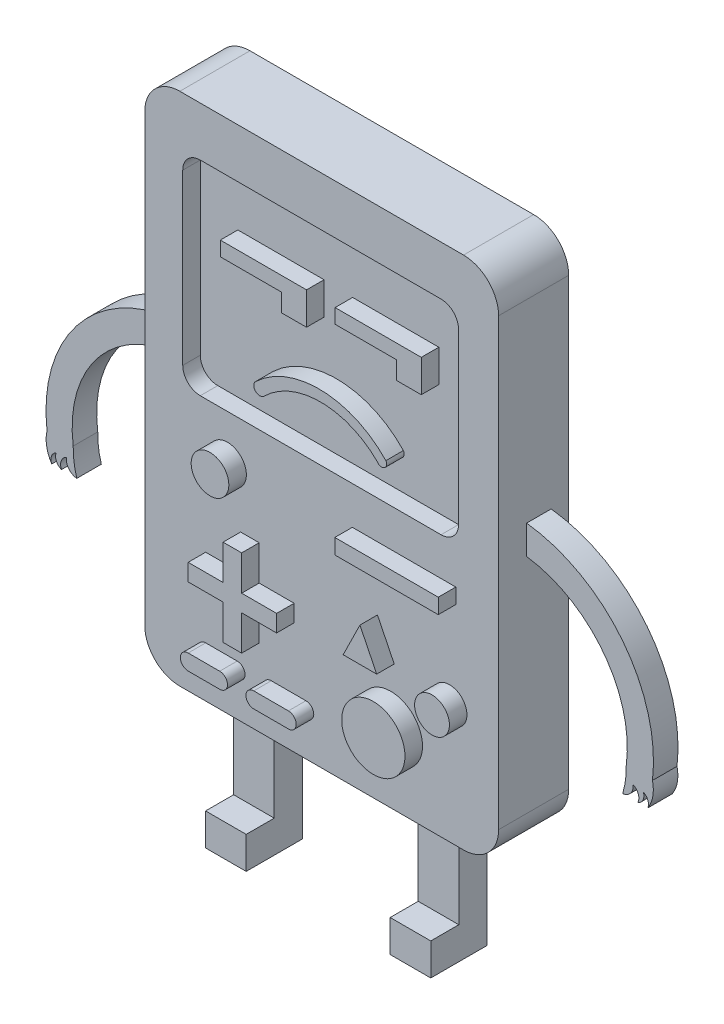
from build123d import *

# Parameters (mm, degrees)
SALIENTE_EXTRUIR1_DEPTH = 20
CORTAR_EXTRUIR1_DEPTH   = 5
CROQUIS4_R              = 5.371921572
CROQUIS4_R_2            = 4.964711246
CROQUIS4_R_3            = 9.020708029
CROQUIS4_W              = 29.502003405
CROQUIS4_H              = 4.3269605
SALIENTE_EXTRUIR2_DEPTH = 5
SALIENTE_EXTRUIR3_DEPTH = 7
SALIENTE_EXTRUIR4_DEPTH = 5
CROQUIS8_W              = 11.57899057
CROQUIS8_H              = 35.30452721
CROQUIS8_W_2            = 11.578990571
SALIENTE_EXTRUIR5_DEPTH = 8
CROQUIS10_W             = 11.578990571
CROQUIS10_H             = 9.157571022
CROQUIS10_W_2           = 11.57899057
SALIENTE_EXTRUIR6_DEPTH = 8


with BuildPart() as part:
    # Croquis2 → Saliente-Extruir1 (new body)
    with BuildSketch(Plane.XY):
        with BuildLine():
            Line((125.948771998, 73.831195148), (206.860426755, 73.831195148))
            ThreePointArc((206.860426755, 73.831195148), (213.931494567, 70.90226296), (216.860426755, 63.831195148))
            Line((216.860426755, 63.831195148), (216.860426755, -63.104823524))
            ThreePointArc((216.860426755, -63.104823524), (213.931494567, -70.175891336), (206.860426755, -73.104823524))
            Line((206.860426755, -73.104823524), (125.948771998, -73.104823524))
            ThreePointArc((125.948771998, -73.104823524), (118.877704186, -70.175891336), (115.948771998, -63.104823524))
            Line((115.948771998, -63.104823524), (115.948771998, 63.831195148))
            ThreePointArc((115.948771998, 63.831195148), (118.877704186, 70.90226296), (125.948771998, 73.831195148))
        make_face()
    extrude(amount=SALIENTE_EXTRUIR1_DEPTH)

    # Croquis3 → Cortar-Extruir1 (cut)
    with BuildSketch(Plane.XY.offset(20)):
        with BuildLine():
            Line((131.777213557, 1.543265948), (200.449222637, 1.543265948))
            ThreePointArc((200.449222637, 1.543265948), (203.984756543, 3.007732042), (205.449222637, 6.543265948))
            Line((205.449222637, 6.543265948), (205.449222637, 54.760552668))
            ThreePointArc((205.449222637, 54.760552668), (203.984756543, 58.296086574), (200.449222637, 59.760552668))
            Line((200.449222637, 59.760552668), (131.777213557, 59.760552668))
            ThreePointArc((131.777213557, 59.760552668), (128.241679651, 58.296086574), (126.777213557, 54.760552668))
            Line((126.777213557, 54.760552668), (126.777213557, 6.543265948))
            ThreePointArc((126.777213557, 6.543265948), (128.241679651, 3.007732042), (131.777213557, 1.543265948))
        make_face()
    extrude(amount=-CORTAR_EXTRUIR1_DEPTH, mode=Mode.SUBTRACT)

    # Croquis4 → Saliente-Extruir2 (add)
    with BuildSketch(Plane.XY.offset(20)):
        with Locations((139.552044207, -11.43761555)):
            Circle(CROQUIS4_R)
        with Locations((202.870894741, -39.254617567)):
            Circle(CROQUIS4_R_2)
        with Locations((186.137514813, -53.312706969)):
            Circle(CROQUIS4_R_3)
        with Locations((189.902130019, -11.43761555)):
            Rectangle(CROQUIS4_W, CROQUIS4_H)
        Polygon((143.285708697, -26.368371403), (148.582533347, -26.368371403), (148.582533347, -36.332523638), (158.546685582, -36.332523638), (158.546685582, -41.173023795), (148.582533347, -41.173023795), (148.582533347, -51.13717603), (143.285708697, -51.13717603), (143.285708697, -41.173023795), (133.321556462, -41.173023795), (133.321556462, -36.332523638), (143.285708697, -36.332523638), align=None)
        Polygon((177.531776564, -37.06014818), (182.312742258, -27.3361267), (187.093707951, -37.06014818), align=None)
        with BuildLine():
            Line((133.321556462, -58.731134755), (142.311995954, -58.731134755))
            ThreePointArc((142.311995954, -58.731134755), (144.543113278, -60.962252079), (142.311995954, -63.193369403))
            Line((142.311995954, -63.193369403), (133.321556462, -63.193369403))
            ThreePointArc((133.321556462, -63.193369403), (131.090439139, -60.962252079), (133.321556462, -58.731134755))
        make_face()
        with BuildLine():
            Line((152.033292864, -58.731134755), (161.913955298, -58.731134755))
            ThreePointArc((161.913955298, -58.731134755), (164.145072622, -60.962252079), (161.913955298, -63.193369403))
            Line((161.913955298, -63.193369403), (152.033292864, -63.193369403))
            ThreePointArc((152.033292864, -63.193369403), (149.802175541, -60.962252079), (152.033292864, -58.731134755))
        make_face()
    extrude(amount=SALIENTE_EXTRUIR2_DEPTH)

    # Croquis5 → Saliente-Extruir3 (add)
    with BuildSketch(Plane.XY.offset(5)):
        with BuildLine():
            Line((216.860426755, 0.363185812), (216.860426755, 8.623746765))
            ThreePointArc((216.860426755, 8.623746765), (244.254011859, -6.758756408), (252.747129342, -37.006018501))
            ThreePointArc((252.747129342, -37.006018501), (252.843911184, -40.891106139), (251.382973951, -44.492346907))
            ThreePointArc((251.382973951, -44.492346907), (251.453339476, -42.564380052), (250.139816979, -41.151345675))
            ThreePointArc((250.139816979, -41.151345675), (250.067291272, -43.138500016), (248.610877543, -44.492346907))
            ThreePointArc((248.610877543, -44.492346907), (248.688866874, -42.355493028), (247.233029791, -40.789362374))
            ThreePointArc((247.233029791, -40.789362374), (246.510434032, -43.257829455), (244.254011859, -44.492346907))
            ThreePointArc((244.254011859, -44.492346907), (245.058759657, -40.789362374), (245.273288479, -37.006018501))
            ThreePointArc((245.273288479, -37.006018501), (238.806273238, -12.436920009), (216.860426755, 0.363185812))
        make_face()
        with BuildLine():
            Line((115.948771998, 0.363185812), (115.948771998, 8.623746765))
            ThreePointArc((115.948771998, 8.623746765), (88.555186894, -6.758756408), (80.062069411, -37.006018501))
            ThreePointArc((80.062069411, -37.006018501), (79.965287568, -40.891106139), (81.426224802, -44.492346907))
            ThreePointArc((81.426224802, -44.492346907), (81.355859277, -42.564380052), (82.669381774, -41.151345675))
            ThreePointArc((82.669381774, -41.151345675), (82.741907481, -43.138500016), (84.19832121, -44.492346907))
            ThreePointArc((84.19832121, -44.492346907), (84.120331879, -42.355493028), (85.576168962, -40.789362374))
            ThreePointArc((85.576168962, -40.789362374), (86.29876472, -43.257829455), (88.555186894, -44.492346907))
            ThreePointArc((88.555186894, -44.492346907), (87.750439096, -40.789362374), (87.535910273, -37.006018501))
            ThreePointArc((87.535910273, -37.006018501), (94.002925515, -12.436920009), (115.948771998, 0.363185812))
        make_face()
    extrude(amount=SALIENTE_EXTRUIR3_DEPTH)

    # Croquis6 → Saliente-Extruir4 (add)
    with BuildSketch(Plane.XY.offset(15)):
        Polygon((170.229054201, 42.546624397), (187.733576221, 42.546624397), (194.814057039, 42.546624397), (194.814057039, 33.30266333), (187.733576221, 33.30266333), (187.733576221, 38.41634392), (170.229054201, 38.41634392), align=None)
        Polygon((137.492636039, 42.846070715), (154.99715806, 42.846070715), (162.077638877, 42.846070715), (162.077638877, 33.602109648), (154.99715806, 33.602109648), (154.99715806, 38.715790239), (137.492636039, 38.715790239), align=None)
        with BuildLine():
            ThreePointArc((147.606658689, 12.985413335), (166.370442462, 20.164117151), (184.714551358, 11.972228552))
            ThreePointArc((184.714551358, 11.972228552), (184.271283015, 10.009183036), (182.308237498, 10.452451378))
            ThreePointArc((182.308237498, 10.452451378), (166.097280974, 17.16724943), (149.88632445, 10.452451378))
            ThreePointArc((149.88632445, 10.452451378), (147.480010591, 10.579099476), (147.606658689, 12.985413335))
        make_face()
    extrude(amount=SALIENTE_EXTRUIR4_DEPTH)

    # Croquis8 → Saliente-Extruir5 (add)
    with BuildSketch(Plane.XY.offset(5)):
        with Locations((192.725958616, -90.757087129)):
            Rectangle(CROQUIS8_W, CROQUIS8_H)
        with Locations((140.083240137, -90.757087129)):
            Rectangle(CROQUIS8_W_2, CROQUIS8_H)
    extrude(amount=SALIENTE_EXTRUIR5_DEPTH)

    # Croquis10 → Saliente-Extruir6 (add)
    with BuildSketch(Plane.XY.offset(13)):
        with Locations((140.083240137, -103.830565223)):
            Rectangle(CROQUIS10_W, CROQUIS10_H)
        with Locations((192.725958616, -103.830565223)):
            Rectangle(CROQUIS10_W_2, CROQUIS10_H)
    extrude(amount=SALIENTE_EXTRUIR6_DEPTH)


solid = part.part
